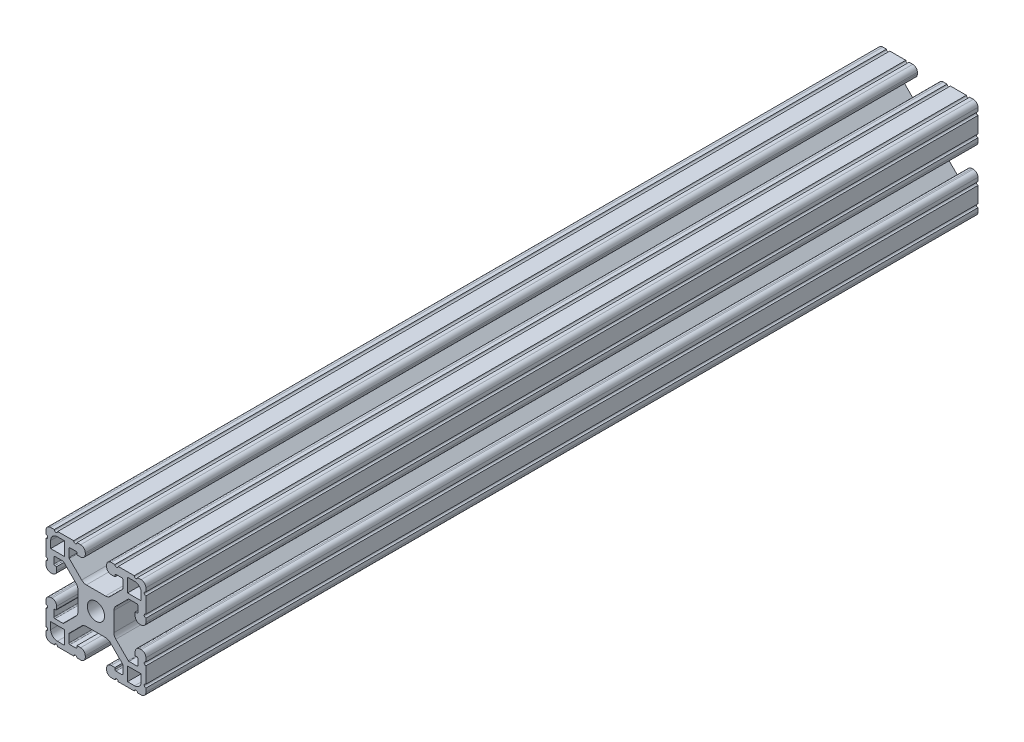
from build123d import *

# Parameters (mm, degrees)
BOSS_EXTRUDE1_DEPTH      = 158.75
BOSS_EXTRUDE1_DEPTH_BACK = 158.75
SKETCH3_W                = 38.1
SKETCH3_H                = 38.1
SKETCH4_W                = 5.207
SKETCH4_H                = 5.207
SKETCH4_R                = 3.302
CUT_EXTRUDE1_DEPTH       = 319.640949973
CUT_EXTRUDE2_DEPTH       = 319.640949973
FILLET1_R                = 2.54
FILLET2_R                = 1.778
FILLET3_R                = 0.396875


with BuildPart() as part:
    # Sketch3 → Boss-Extrude1 (new, two sides: drawn at the far end of the back side and taken through both)
    with BuildSketch(Plane.XY.offset(-BOSS_EXTRUDE1_DEPTH_BACK)):
        Rectangle(SKETCH3_W, SKETCH3_H)
    extrude(amount=BOSS_EXTRUDE1_DEPTH + BOSS_EXTRUDE1_DEPTH_BACK)

    # Sketch4 → Cut-Extrude1 (cut, through all)
    with BuildSketch(Plane.XY.offset(158.75)):
        Polygon((7.239, 14.986), (4.064, 14.986), (4.064, 19.05), (-4.064, 19.05), (-4.064, 14.986), (-7.239, 14.986), (-7.239, 16.002), (-10.287, 16.002), (-10.287, 12.442261469), (-4.702738531, 6.858), (4.702738531, 6.858), (10.287, 12.442261469), (10.287, 16.002), (7.239, 16.002), align=None)
        Polygon((10.287, -12.442261469), (4.702738531, -6.858), (-4.702738531, -6.858), (-10.287, -12.442261469), (-10.287, -16.002), (-7.239, -16.002), (-7.239, -14.986), (-4.064, -14.986), (-4.064, -19.05), (4.064, -19.05), (4.064, -14.986), (7.239, -14.986), (7.239, -16.002), (10.287, -16.002), align=None)
        Polygon((-12.442261469, -10.287), (-6.858, -4.702738531), (-6.858, 4.702738531), (-12.442261469, 10.287), (-16.002, 10.287), (-16.002, 7.239), (-14.986, 7.239), (-14.986, 4.064), (-19.05, 4.064), (-19.05, -4.064), (-14.986, -4.064), (-14.986, -7.239), (-16.002, -7.239), (-16.002, -10.287), align=None)
        Polygon((14.986, -7.239), (14.986, -4.064), (19.05, -4.064), (19.05, 4.064), (14.986, 4.064), (14.986, 7.239), (16.002, 7.239), (16.002, 10.287), (12.442261469, 10.287), (6.858, 4.702738531), (6.858, -4.702738531), (12.442261469, -10.287), (16.002, -10.287), (16.002, -7.239), align=None)
        with Locations((14.6685, 14.6685)):
            Rectangle(SKETCH4_W, SKETCH4_H)
        with Locations((14.6685, -14.6685)):
            Rectangle(SKETCH4_W, SKETCH4_H)
        with Locations((-14.6685, 14.6685)):
            Rectangle(SKETCH4_W, SKETCH4_H)
        with Locations((-14.6685, -14.6685)):
            Rectangle(SKETCH4_W, SKETCH4_H)
        Circle(SKETCH4_R)
    extrude(amount=-CUT_EXTRUDE1_DEPTH, mode=Mode.SUBTRACT)

    # Sketch5 → Cut-Extrude2 (cut, through all)
    with BuildSketch(Plane.XY.offset(158.75)):
        with BuildLine():
            Line((-14.605, 19.05), (-15.875, 19.05))
            ThreePointArc((-15.875, 19.05), (-15.24, 18.415), (-14.605, 19.05))
        make_face()
        with BuildLine():
            Line((-7.239, 19.05), (-8.509, 19.05))
            ThreePointArc((-8.509, 19.05), (-7.874, 18.415), (-7.239, 19.05))
        make_face()
        with BuildLine():
            ThreePointArc((-19.05, 14.605), (-18.415, 15.24), (-19.05, 15.875))
            Line((-19.05, 15.875), (-19.05, 14.605))
        make_face()
        with BuildLine():
            ThreePointArc((-19.05, 7.239), (-18.415, 7.874), (-19.05, 8.509))
            Line((-19.05, 8.509), (-19.05, 7.239))
        make_face()
        with BuildLine():
            ThreePointArc((7.239, 19.05), (7.874, 18.415), (8.509, 19.05))
            Line((8.509, 19.05), (7.239, 19.05))
        make_face()
        with BuildLine():
            ThreePointArc((14.605, 19.05), (15.24, 18.415), (15.875, 19.05))
            Line((15.875, 19.05), (14.605, 19.05))
        make_face()
        with BuildLine():
            Line((19.05, 14.605), (19.05, 15.875))
            ThreePointArc((19.05, 15.875), (18.415, 15.24), (19.05, 14.605))
        make_face()
        with BuildLine():
            Line((19.05, 7.239), (19.05, 8.509))
            ThreePointArc((19.05, 8.509), (18.415, 7.874), (19.05, 7.239))
        make_face()
        with BuildLine():
            ThreePointArc((19.05, -7.239), (18.415, -7.874), (19.05, -8.509))
            Line((19.05, -8.509), (19.05, -7.239))
        make_face()
        with BuildLine():
            ThreePointArc((19.05, -14.605), (18.415, -15.24), (19.05, -15.875))
            Line((19.05, -15.875), (19.05, -14.605))
        make_face()
        with BuildLine():
            Line((14.605, -19.05), (15.875, -19.05))
            ThreePointArc((15.875, -19.05), (15.24, -18.415), (14.605, -19.05))
        make_face()
        with BuildLine():
            Line((7.239, -19.05), (8.509, -19.05))
            ThreePointArc((8.509, -19.05), (7.874, -18.415), (7.239, -19.05))
        make_face()
        with BuildLine():
            ThreePointArc((-7.239, -19.05), (-7.874, -18.415), (-8.509, -19.05))
            Line((-8.509, -19.05), (-7.239, -19.05))
        make_face()
        with BuildLine():
            ThreePointArc((-14.605, -19.05), (-15.24, -18.415), (-15.875, -19.05))
            Line((-15.875, -19.05), (-14.605, -19.05))
        make_face()
        with BuildLine():
            Line((-19.05, -14.605), (-19.05, -15.875))
            ThreePointArc((-19.05, -15.875), (-18.415, -15.24), (-19.05, -14.605))
        make_face()
        with BuildLine():
            Line((-19.05, -7.239), (-19.05, -8.509))
            ThreePointArc((-19.05, -8.509), (-18.415, -7.874), (-19.05, -7.239))
        make_face()
    extrude(amount=-CUT_EXTRUDE2_DEPTH, mode=Mode.SUBTRACT)

    # Fillet1
    fillet1_edges = [part.edges().sort_by_distance(p)[0] for p in [
        (6.858, -4.702738531, 0),
        (6.858, 4.702738531, 0),
        (-17.272, 17.272, 0),
        (-17.272, -17.272, 0),
        (17.272, -17.272, 0),
        (17.272, 17.272, 0),
        (-4.702738531, -6.858, 0),
        (4.702738531, -6.858, 0),
        (-6.858, 4.702738531, 0),
        (-6.858, -4.702738531, 0),
        (4.702738531, 6.858, 0),
        (-4.702738531, 6.858, 0),
    ]]
    fillet(fillet1_edges, radius=FILLET1_R)

    # Fillet2
    fillet2_edges = [part.edges().sort_by_distance(p)[0] for p in [
        (14.986, 4.064, 0),
        (19.05, 4.064, 0),
        (19.05, -4.064, 0),
        (14.986, -4.064, 0),
        (4.064, -14.986, 0),
        (4.064, -19.05, 0),
        (-4.064, -19.05, 0),
        (-4.064, -14.986, 0),
        (-14.986, -4.064, 0),
        (-19.05, -4.064, 0),
        (-19.05, 4.064, 0),
        (-14.986, 4.064, 0),
        (-19.05, 19.05, 0),
        (19.05, 19.05, 0),
        (19.05, -19.05, 0),
        (-19.05, -19.05, 0),
        (-4.064, 14.986, 0),
        (-4.064, 19.05, 0),
        (4.064, 19.05, 0),
        (4.064, 14.986, 0),
    ]]
    fillet(fillet2_edges, radius=FILLET2_R)

    # Fillet3
    fillet3_edges = [part.edges().sort_by_distance(p)[0] for p in [
        (12.442261469, 10.287, 0),
        (16.002, 10.287, 0),
        (16.002, 7.239, 0),
        (16.002, -7.239, 0),
        (16.002, -10.287, 0),
        (12.442261469, -10.287, 0),
        (-7.239, -16.002, 0),
        (-10.287, -16.002, 0),
        (-10.287, -12.442261469, 0),
        (10.287, -12.442261469, 0),
        (10.287, -16.002, 0),
        (7.239, -16.002, 0),
        (-16.002, 7.239, 0),
        (-16.002, 10.287, 0),
        (-12.442261469, 10.287, 0),
        (-12.442261469, -10.287, 0),
        (-16.002, -10.287, 0),
        (-14.986, -7.239, 0),
        (-10.287, 12.442261469, 0),
        (-10.287, 16.002, 0),
        (-7.239, 16.002, 0),
        (7.239, 16.002, 0),
        (10.287, 16.002, 0),
        (10.287, 12.442261469, 0),
    ]]
    fillet(fillet3_edges, radius=FILLET3_R)


solid = part.part
